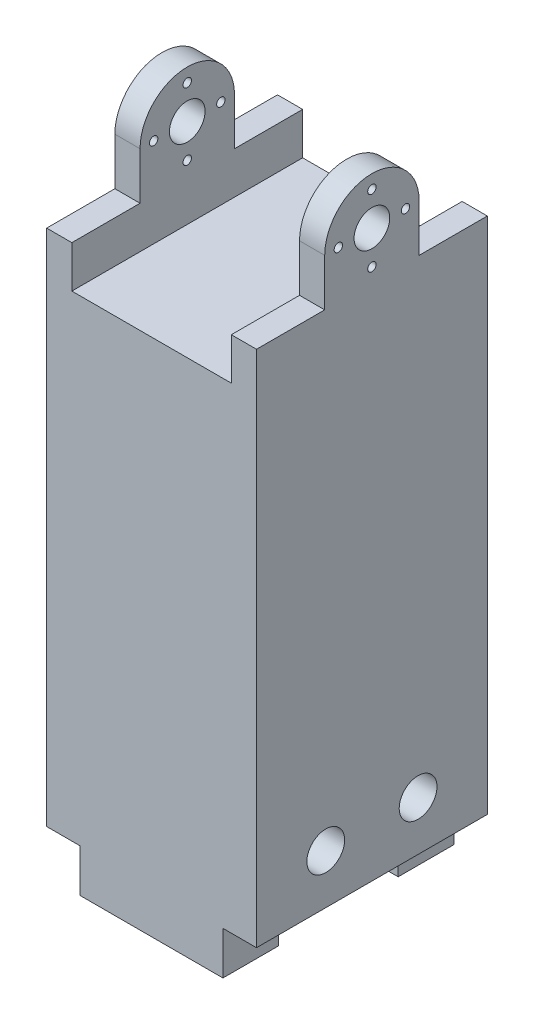
from build123d import *

# Parameters (mm, degrees)
SKETCH1_W           = 50
SKETCH1_H           = 170
BOSS_EXTRUDE1_DEPTH = 55
SKETCH2_W           = 34
SKETCH2_H           = 27
CUT_EXTRUDE1_DEPTH  = 181.416185527
SKETCH3_W           = 10
SKETCH3_H           = 24
SKETCH3_R           = 4.25
SKETCH3_R_2         = 1
CUT_EXTRUDE2_DEPTH  = 186.539753153
SKETCH4_W           = 2
SKETCH4_H           = 24
CUT_EXTRUDE3_DEPTH  = 178.623196683
SKETCH5_W           = 6.25
SKETCH5_H           = 11.25
CUT_EXTRUDE4_DEPTH  = 186.539753153
SKETCH6_W           = 38
SKETCH6_H           = 10
CUT_EXTRUDE5_DEPTH  = 181.416185527
SKETCH8_W           = 13.25
SKETCH8_H           = 2.25
CUT_EXTRUDE7_DEPTH  = 186.539753153
SKETCH9_W           = 34
SKETCH9_H           = 35.25
CUT_EXTRUDE8_DEPTH  = 179.297679458
SKETCH11_W          = 13.25
SKETCH11_H          = 20.25
CUT_EXTRUDE9_DEPTH  = 184.480414486
SKETCH12_W          = 28.5
SKETCH12_H          = 15
BOSS_EXTRUDE2_DEPTH = 8
SKETCH14_W          = 34
SKETCH14_H          = 15
SKETCH14_H_2        = 10.25
BOSS_EXTRUDE3_DEPTH = 13.25
SKETCH16_R          = 4.5
SKETCH16_R_2        = 2.5
CUT_EXTRUDE13_DEPTH = 8


with BuildPart() as part:
    # Sketch1 → Boss-Extrude1 (new body)
    with BuildSketch(Plane.XY):
        with Locations((0, -85)):
            Rectangle(SKETCH1_W, SKETCH1_H)
    extrude(amount=-BOSS_EXTRUDE1_DEPTH)

    # Sketch2 → Cut-Extrude1 (cut, through all)
    with BuildSketch(Plane.XY):
        with Locations((0, -13.5)):
            Rectangle(SKETCH2_W, SKETCH2_H)
    extrude(amount=-CUT_EXTRUDE1_DEPTH, mode=Mode.SUBTRACT)

    # Sketch3 → Cut-Extrude2 (cut, through all)
    with BuildSketch(Plane(origin=(25, 0, 0), x_dir=(0, 0, -1), z_dir=(1, 0, 0))):
        with Locations((50, -12)):
            Rectangle(SKETCH3_W, SKETCH3_H)
        with Locations((5, -12)):
            Rectangle(SKETCH3_W, SKETCH3_H)
        with Locations(Location((27.5, -12.75, 0), (0, 0, 90))):
            Circle(SKETCH3_R)
        with Locations(Location((35.5, -12.75, 0), (0, 0, 90))):
            Circle(SKETCH3_R_2)
        with Locations(Location((27.5, -4.75, 0), (0, 0, 90))):
            Circle(SKETCH3_R_2)
        with Locations(Location((27.5, -20.75, 0), (0, 0, 90))):
            Circle(SKETCH3_R_2)
        with Locations(Location((19.5, -12.75, 0), (0, 0, 90))):
            Circle(SKETCH3_R_2)
    extrude(amount=-CUT_EXTRUDE2_DEPTH, mode=Mode.SUBTRACT)

    # Sketch4 → Cut-Extrude3 (cut, through all)
    with BuildSketch(Plane.XY.offset(-10)):
        with Locations((-18, -12)):
            Rectangle(SKETCH4_W, SKETCH4_H)
        with Locations((18, -12)):
            Rectangle(SKETCH4_W, SKETCH4_H)
    extrude(amount=-CUT_EXTRUDE3_DEPTH, mode=Mode.SUBTRACT)

    # Sketch5 → Cut-Extrude4 (cut, through all)
    with BuildSketch(Plane(origin=(25, 0, 0), x_dir=(0, 0, -1), z_dir=(1, 0, 0))):
        with BuildLine():
            Line((45, 0), (10, 0))
            Line((10, 0), (10, -12.75))
            Line((10, -12.75), (16.25, -12.75))
            ThreePointArc((16.25, -12.75), (27.5, -1.5), (38.75, -12.75))
            Line((38.75, -12.75), (45, -12.75))
            Line((45, -12.75), (45, 0))
        make_face()
        with Locations((13.125, -18.375)):
            Rectangle(SKETCH5_W, SKETCH5_H)
        with Locations((41.875, -18.375)):
            Rectangle(SKETCH5_W, SKETCH5_H)
    extrude(amount=-CUT_EXTRUDE4_DEPTH, mode=Mode.SUBTRACT)

    # Sketch6 → Cut-Extrude5 (cut, through all)
    with BuildSketch(Plane.XY):
        with Locations((0, -29)):
            Rectangle(SKETCH6_W, SKETCH6_H)
    extrude(amount=-CUT_EXTRUDE5_DEPTH, mode=Mode.SUBTRACT)

    # Sketch8 → Cut-Extrude7 (cut, through all)
    with BuildSketch(Plane(origin=(25, 0, 0), x_dir=(0, 0, -1), z_dir=(1, 0, 0))):
        with BuildLine():
            Line((27.5, -157.5), (27.5, -132.5))
            Line((27.5, -132.5), (13.25, -132.5))
            Line((13.25, -132.5), (13.25, -167.75))
            Line((13.25, -167.75), (17.25, -167.75))
            ThreePointArc((17.25, -167.75), (20.252155493, -160.502155493), (27.5, -157.5))
        make_face()
        with BuildLine():
            Line((41.75, -167.75), (41.75, -132.5))
            Line((41.75, -132.5), (27.5, -132.5))
            Line((27.5, -132.5), (27.5, -157.5))
            ThreePointArc((27.5, -157.5), (34.747844507, -160.502155493), (37.75, -167.75))
            Line((37.75, -167.75), (41.75, -167.75))
        make_face()
        with Locations((48.375, -168.875)):
            Rectangle(SKETCH8_W, SKETCH8_H)
        with Locations((6.625, -168.875)):
            Rectangle(SKETCH8_W, SKETCH8_H)
        with BuildLine():
            Line((17.25, -167.75), (13.25, -167.75))
            Line((13.25, -167.75), (13.25, -170))
            Line((13.25, -170), (17.5, -170))
            ThreePointArc((17.5, -170), (17.31269172, -168.881923142), (17.25, -167.75))
        make_face()
        with BuildLine():
            Line((41.75, -170), (41.75, -167.75))
            Line((41.75, -167.75), (37.75, -167.75))
            ThreePointArc((37.75, -167.75), (37.68730828, -168.881923142), (37.5, -170))
            Line((37.5, -170), (41.75, -170))
        make_face()
        with BuildLine():
            Line((27.5, -167.75), (27.5, -157.5))
            ThreePointArc((27.5, -157.5), (20.252155493, -160.502155493), (17.25, -167.75))
            Line((17.25, -167.75), (27.5, -167.75))
        make_face()
        with BuildLine():
            ThreePointArc((37.75, -167.75), (34.747844507, -160.502155493), (27.5, -157.5))
            Line((27.5, -157.5), (27.5, -167.75))
            Line((27.5, -167.75), (37.75, -167.75))
        make_face()
        with BuildLine():
            Line((27.5, -170), (27.5, -167.75))
            Line((27.5, -167.75), (17.25, -167.75))
            ThreePointArc((17.25, -167.75), (17.31269172, -168.881923142), (17.5, -170))
            Line((17.5, -170), (27.5, -170))
        make_face()
        with BuildLine():
            ThreePointArc((37.5, -170), (37.68730828, -168.881923142), (37.75, -167.75))
            Line((37.75, -167.75), (27.5, -167.75))
            Line((27.5, -167.75), (27.5, -170))
            Line((27.5, -170), (37.5, -170))
        make_face()
    extrude(amount=-CUT_EXTRUDE7_DEPTH, mode=Mode.SUBTRACT)

    # Sketch9 → Cut-Extrude8 (cut, through all)
    with BuildSketch(Plane.XY):
        with Locations((0, -150.125)):
            Rectangle(SKETCH9_W, SKETCH9_H)
    extrude(amount=-CUT_EXTRUDE8_DEPTH, mode=Mode.SUBTRACT)

    # Sketch11 → Cut-Extrude9 (cut, through all)
    with BuildSketch(Plane(origin=(25, 0, 0), x_dir=(0, 0, -1), z_dir=(1, 0, 0))):
        with BuildLine():
            ThreePointArc((17.25, -167.75), (20.252155493, -160.502155493), (27.5, -157.5))
            Line((27.5, -157.5), (27.5, -147.5))
            Line((27.5, -147.5), (13.25, -147.5))
            Line((13.25, -147.5), (13.25, -167.75))
            Line((13.25, -167.75), (17.25, -167.75))
        make_face()
        with BuildLine():
            Line((27.5, -147.5), (27.5, -157.5))
            ThreePointArc((27.5, -157.5), (34.747844507, -160.502155493), (37.75, -167.75))
            Line((37.75, -167.75), (41.75, -167.75))
            Line((41.75, -167.75), (41.75, -147.5))
            Line((41.75, -147.5), (27.5, -147.5))
        make_face()
        with Locations((48.375, -157.625)):
            Rectangle(SKETCH11_W, SKETCH11_H)
        with Locations((6.625, -157.625)):
            Rectangle(SKETCH11_W, SKETCH11_H)
    extrude(amount=-CUT_EXTRUDE9_DEPTH, mode=Mode.SUBTRACT)

    # Sketch12 → Boss-Extrude2 (add)
    with BuildSketch(Plane(origin=(25, 0, 0), x_dir=(0, 0, -1), z_dir=(1, 0, 0))):
        with Locations((27.5, -140)):
            Rectangle(SKETCH12_W, SKETCH12_H)
    boss_extrude2 = extrude(amount=-BOSS_EXTRUDE2_DEPTH)

    # Mirror1: Boss-Extrude2 across plane
    add(boss_extrude2.mirror(Plane(origin=(0, 0, 0), x_dir=(0, 0, 1), z_dir=(1, 0, 0))))

    # Sketch14 → Boss-Extrude3 (add)
    with BuildSketch(Plane.XY):
        with Locations((0, -140)):
            Rectangle(SKETCH14_W, SKETCH14_H)
        with Locations((0, -152.625)):
            Rectangle(SKETCH14_W, SKETCH14_H_2)
    boss_extrude3 = extrude(amount=-BOSS_EXTRUDE3_DEPTH)

    # Mirror2: Boss-Extrude3 across plane
    add(boss_extrude3.mirror(Plane.XY.offset(-27.5)))

    # Sketch16 → Cut-Extrude13 (cut)
    # profile 1 of 3: a face of its own
    with BuildSketch(Plane(origin=(25, 0, 0), x_dir=(0, 0, -1), z_dir=(1, 0, 0))):
        with Locations(Location((16.5, -135.75, 0), (0, 0, 90))):
            Circle(SKETCH16_R)
        with Locations((16.5, -135.75)):
            Circle(SKETCH16_R_2, mode=Mode.SUBTRACT)
    # profile 2 of 3: a face of its own
    with BuildSketch(Plane(origin=(25, 0, 0), x_dir=(0, 0, -1), z_dir=(1, 0, 0))):
        with Locations((16.5, -135.75)):
            Circle(SKETCH16_R_2)
    # profile 3 of 3: a face of its own
    with BuildSketch(Plane(origin=(25, 0, 0), x_dir=(0, 0, -1), z_dir=(1, 0, 0))):
        with Locations(Location((38.5, -135.75, 0), (0, 0, 90))):
            Circle(SKETCH16_R)
    cut_extrude13 = extrude(amount=-CUT_EXTRUDE13_DEPTH, mode=Mode.SUBTRACT)

    # Mirror3: Cut-Extrude13 across plane
    add(cut_extrude13.mirror(Plane(origin=(0, 0, 0), x_dir=(0, 0, 1), z_dir=(1, 0, 0))), mode=Mode.SUBTRACT)


solid = part.part
